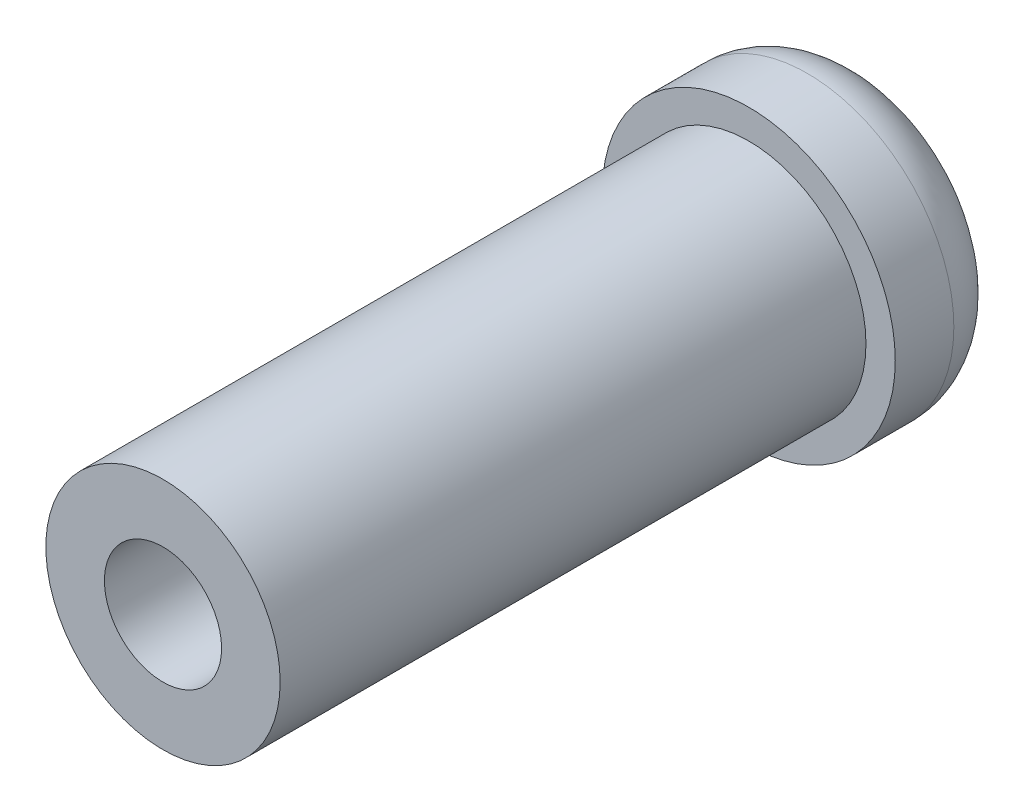
from build123d import *

# Parameters (mm, degrees)
ESQUISSE1_R        = 2.5
BOSS_EXTRU_1_DEPTH = 2
ESQUISSE2_R        = 2
ESQUISSE2_R_2      = 1
BOSS_EXTRU_2_DEPTH = 10
CONG_1_R           = 1


with BuildPart() as part:
    # Esquisse1 → Boss.-Extru.1 (new body)
    with BuildSketch(Plane.XY):
        Circle(ESQUISSE1_R)
    extrude(amount=BOSS_EXTRU_1_DEPTH)

    # Esquisse2 → Boss.-Extru.2 (add)
    with BuildSketch(Plane.XY.offset(2)):
        Circle(ESQUISSE2_R)
        Circle(ESQUISSE2_R_2, mode=Mode.SUBTRACT)
    extrude(amount=BOSS_EXTRU_2_DEPTH)

    # Congé1
    cong_1_edges = [part.edges().sort_by_distance(p)[0] for p in [
        (-2.5, 0, 0),
    ]]
    fillet(cong_1_edges, radius=CONG_1_R)


solid = part.part
